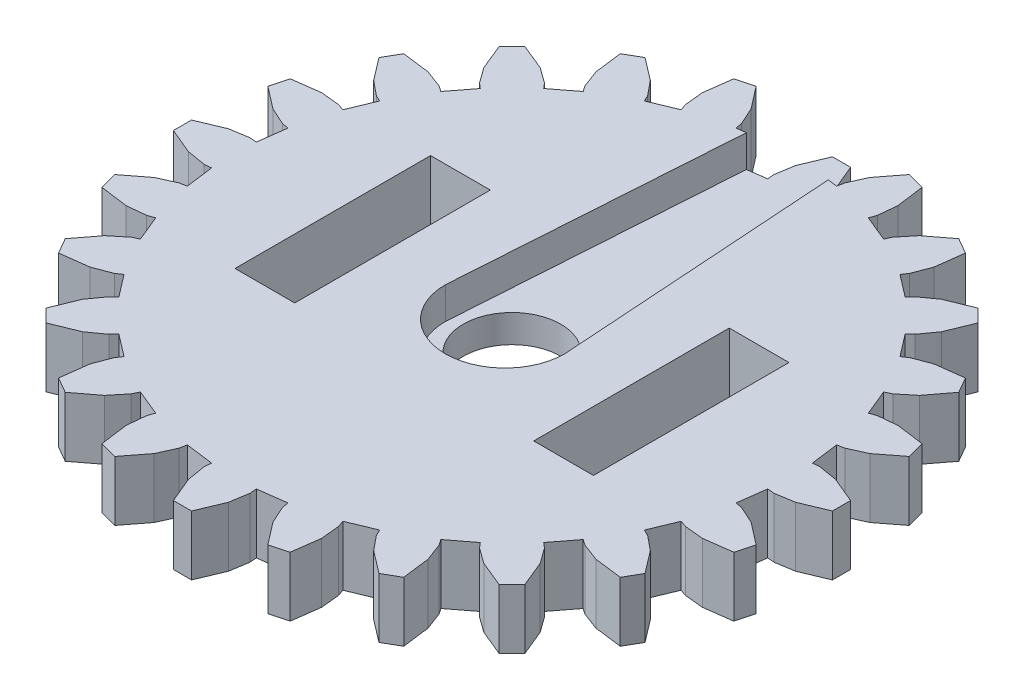
from build123d import *

# Parameters (mm, degrees)
SKETCH1_R           = 2.45
BOSS_EXTRUDE1_DEPTH = 3
SKETCH2_W           = 3
SKETCH2_H           = 9.82
CUT_EXTRUDE1_DEPTH  = 3
CUT_EXTRUDE2_DEPTH  = 1.6


with BuildPart() as part:
    # Sketch1 → Boss-Extrude1 (new body)
    with BuildSketch(Plane(origin=(0, 0, 0), x_dir=(1, 0, 0), z_dir=(0, 1, 0))):
        Polygon((13.971400219, 1.464735526), (14.322080219, 1.492975526), (15.257120219, 1.339825526), (16.556810219, 0.796015526), (16.556810219, -0.114944474), (15.257120219, -0.658754474), (14.322080219, -0.811904474), (13.971400219, -0.783664474), (13.786680219, -2.186794474), (14.132710219, -2.250284474), (14.996260219, -2.640224474), (16.110910219, -3.501884474), (15.875130219, -4.381804474), (14.478990219, -4.570694474), (13.536170219, -4.476624474), (13.204750219, -4.358584474), (12.663160219, -5.666094474), (12.980970219, -5.816984474), (13.714170219, -6.417134474), (14.567820219, -7.537934474), (14.112340219, -8.326844474), (12.714880219, -8.147954474), (11.828530219, -7.813064474), (11.538960219, -7.613274474), (10.677410219, -8.736054474), (10.945350219, -8.964054474), (11.498230219, -9.733524474), (12.032710219, -11.037074474), (11.388570219, -11.681214474), (10.085020219, -11.146734474), (9.315550219, -10.593854474), (9.087550219, -10.325914474), (7.964770219, -11.187464474), (8.164560219, -11.477034474), (8.499450219, -12.363384474), (8.678340219, -13.760844474), (7.889430219, -14.216324474), (6.768630219, -13.362674474), (6.168480219, -12.629474474), (6.017590219, -12.311664474), (4.710080219, -12.853254474), (4.828120219, -13.184674474), (4.922190219, -14.127494474), (4.733300219, -15.523634474), (3.853380219, -15.759414474), (2.991720219, -14.644764474), (2.601780219, -13.781214474), (2.538290219, -13.435184474), (1.135160219, -13.619904474), (1.163400219, -13.970584474), (1.010250219, -14.905624474), (0.466440219, -16.205314474), (-0.444519781, -16.205314474), (-0.988329781, -14.905624474), (-1.141479781, -13.970584474), (-1.113239781, -13.619904474), (-2.516369781, -13.435184474), (-2.579859781, -13.781214474), (-2.969799781, -14.644764474), (-3.831459781, -15.759414474), (-4.711379781, -15.523634474), (-4.900269781, -14.127494474), (-4.806199781, -13.184674474), (-4.688159781, -12.853254474), (-5.995669781, -12.311664474), (-6.146559781, -12.629474474), (-6.746709781, -13.362674474), (-7.867509781, -14.216324474), (-8.656419781, -13.760844474), (-8.477529781, -12.363384474), (-8.142639781, -11.477034474), (-7.942849781, -11.187464474), (-9.065629781, -10.325914474), (-9.293629781, -10.593854474), (-10.063099781, -11.146734474), (-11.366649781, -11.681214474), (-12.010789781, -11.037074474), (-11.476309781, -9.733524474), (-10.923429781, -8.964054474), (-10.655489781, -8.736054474), (-11.517039781, -7.613274474), (-11.806609781, -7.813064474), (-12.692959781, -8.147954474), (-14.090419781, -8.326844474), (-14.545899781, -7.537934474), (-13.692249781, -6.417134474), (-12.959049781, -5.816984474), (-12.641239781, -5.666094474), (-13.182829781, -4.358584474), (-13.514249781, -4.476624474), (-14.457069781, -4.570694474), (-15.853209781, -4.381804474), (-16.088989781, -3.501884474), (-14.974339781, -2.640224474), (-14.110789781, -2.250284474), (-13.764759781, -2.186794474), (-13.949479781, -0.783664474), (-14.300159781, -0.811904474), (-15.235199781, -0.658754474), (-16.534889781, -0.114944474), (-16.534889781, 0.796015526), (-15.235199781, 1.339825526), (-14.300159781, 1.492975526), (-13.949479781, 1.464735526), (-13.764759781, 2.867865526), (-14.110789781, 2.931355526), (-14.974339781, 3.321295526), (-16.088989781, 4.182955526), (-15.853209781, 5.062875526), (-14.457069781, 5.251765526), (-13.514249781, 5.157695526), (-13.182829781, 5.039655526), (-12.641239781, 6.347165526), (-12.959049781, 6.498055526), (-13.692249781, 7.098205526), (-14.545899781, 8.219005526), (-14.090419781, 9.007915526), (-12.692959781, 8.829025526), (-11.806609781, 8.494135526), (-11.517039781, 8.294345526), (-10.655489781, 9.417125526), (-10.923429781, 9.645125526), (-11.476309781, 10.414595526), (-12.010789781, 11.718145526), (-11.366649781, 12.362285526), (-10.063099781, 11.827805526), (-9.293629781, 11.274925526), (-9.065629781, 11.006985526), (-7.942849781, 11.868535526), (-8.142639781, 12.158105526), (-8.477529781, 13.044455526), (-8.656419781, 14.441915526), (-7.867509781, 14.897395526), (-6.746709781, 14.043745526), (-6.146559781, 13.310545526), (-5.995669781, 12.992735526), (-4.688159781, 13.534325526), (-4.806199781, 13.865745526), (-4.900269781, 14.808565526), (-4.711379781, 16.204705526), (-3.831459781, 16.440485526), (-2.969799781, 15.325835526), (-2.579859781, 14.462285526), (-2.516369781, 14.116255526), (-1.113239781, 14.300975526), (-1.141479781, 14.651655526), (-0.988329781, 15.586695526), (-0.444519781, 16.886385526), (0.466440219, 16.886385526), (1.010250219, 15.586695526), (1.163400219, 14.651655526), (1.135160219, 14.300975526), (2.538290219, 14.116255526), (2.601780219, 14.462285526), (2.991720219, 15.325835526), (3.853380219, 16.440485526), (4.733300219, 16.204705526), (4.922190219, 14.808565526), (4.828120219, 13.865745526), (4.710080219, 13.534325526), (6.017590219, 12.992735526), (6.168480219, 13.310545526), (6.768630219, 14.043745526), (7.889430219, 14.897395526), (8.678340219, 14.441915526), (8.499450219, 13.044455526), (8.164560219, 12.158105526), (7.964770219, 11.868535526), (9.087550219, 11.006985526), (9.315550219, 11.274925526), (10.085020219, 11.827805526), (11.388570219, 12.362285526), (12.032710219, 11.718145526), (11.498230219, 10.414595526), (10.945350219, 9.645125526), (10.677410219, 9.417125526), (11.538960219, 8.294345526), (11.828530219, 8.494135526), (12.714880219, 8.829025526), (14.112340219, 9.007915526), (14.567820219, 8.219005526), (13.714170219, 7.098205526), (12.980970219, 6.498055526), (12.663160219, 6.347165526), (13.204750219, 5.039655526), (13.536170219, 5.157695526), (14.478990219, 5.251765526), (15.875130219, 5.062875526), (16.110910219, 4.182955526), (14.996260219, 3.321295526), (14.132710219, 2.931355526), (13.786680219, 2.867865526), align=None)
        with Locations(Location((0.010960219, 0.340535526, 0), (0, 0, 270))):
            Circle(SKETCH1_R, mode=Mode.SUBTRACT)
    extrude(amount=BOSS_EXTRUDE1_DEPTH)

    # Sketch2 → Cut-Extrude1 (cut)
    with BuildSketch(Plane(origin=(0, 3, 0), x_dir=(1, 0, 0), z_dir=(0, 1, 0))):
        with Locations((-7.489039781, 0.340535526)):
            Rectangle(SKETCH2_W, SKETCH2_H)
        with Locations((7.510960219, 0.340535526)):
            Rectangle(SKETCH2_W, SKETCH2_H)
    extrude(amount=-CUT_EXTRUDE1_DEPTH, mode=Mode.SUBTRACT)

    # Sketch3 → Cut-Extrude2 (cut)
    with BuildSketch(Plane(origin=(0, 3, 0), x_dir=(1, 0, 0), z_dir=(0, 1, 0))):
        with BuildLine():
            Line((-3, 0), (-1.97657097, 15.305233024))
            ThreePointArc((-1.97657097, 15.305233024), (0, 17), (1.97657097, 15.305233024))
            Line((1.97657097, 15.305233024), (3, 0))
            ThreePointArc((3, 0), (0, -3), (-3, 0))
        make_face()
    extrude(amount=-CUT_EXTRUDE2_DEPTH, mode=Mode.SUBTRACT)


solid = part.part
